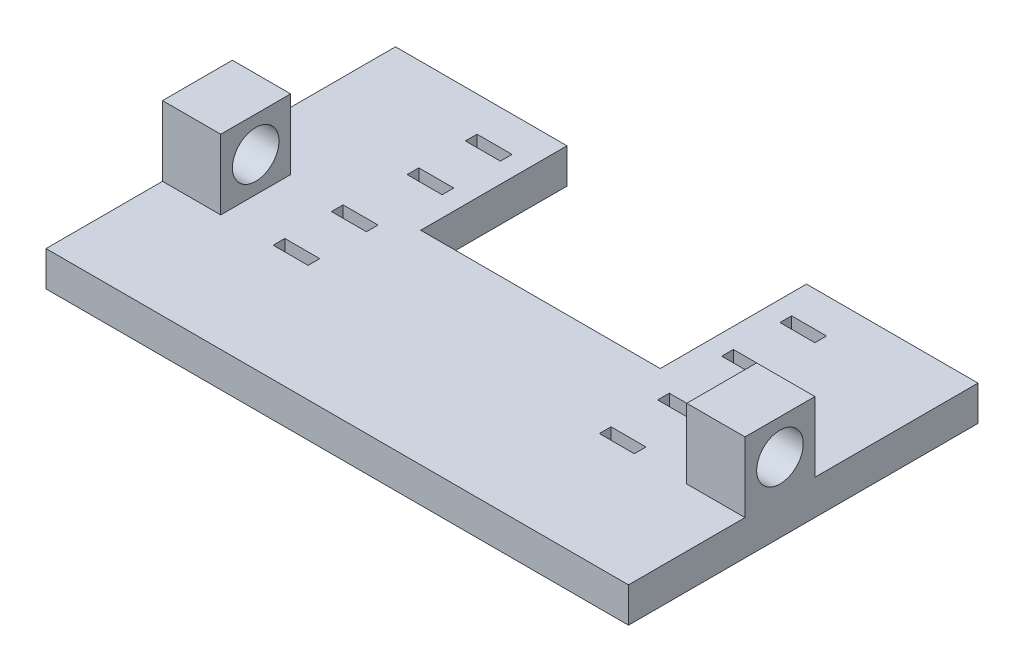
from build123d import *

# Parameters (mm, degrees)
SKETCH1_W                = 6
SKETCH1_H                = 8
BOSS_EXTRUDE1_DEPTH      = 3
SKETCH3_W                = 5
SKETCH3_H                = 6
BOSS_EXTRUDE3_DEPTH      = 6
SKETCH4_R                = 2
CUT_EXTRUDE1_DEPTH       = 53.971690553
BOSS_EXTRUDE4_DEPTH      = 6
BOSS_EXTRUDE4_DEPTH_BACK = 3
SKETCH5_W                = 6
SKETCH5_H                = 8
SKETCH6_R                = 2
CUT_EXTRUDE2_DEPTH       = 6
SKETCH7_W                = 3
SKETCH7_H                = 1
CUT_EXTRUDE3_DEPTH       = 10
CUT_EXTRUDE4_DEPTH       = 10
CUT_EXTRUDE4_DEPTH_BACK  = 10
SKETCH8_W                = 3
SKETCH8_H                = 1
SKETCH8_W_2              = 20.55867335
SKETCH8_H_2              = 13.11372747


with BuildPart() as part:
    # Sketch1 → Boss-Extrude1 (new body)
    with BuildSketch(Plane(origin=(0, 0, 0), x_dir=(1, 0, 0), z_dir=(0, 1, 0))):
        Polygon((3, 15), (25, 15), (25, -15), (-25, -15), (-25, 15), (-3, 15), align=None)
        with Locations((0, 9)):
            Rectangle(SKETCH1_W, SKETCH1_H, mode=Mode.SUBTRACT)
    extrude(amount=BOSS_EXTRUDE1_DEPTH)

    # Sketch3 → Boss-Extrude3 (add)
    with BuildSketch(Plane(origin=(0, 3, 0), x_dir=(1, 0, 0), z_dir=(0, 1, 0))):
        with Locations((-22.5, -2)):
            Rectangle(SKETCH3_W, SKETCH3_H)
        with Locations((22.5, -2)):
            Rectangle(SKETCH3_W, SKETCH3_H)
    extrude(amount=BOSS_EXTRUDE3_DEPTH)

    # Sketch4 → Cut-Extrude1 (cut, through all)
    with BuildSketch(Plane.ZY.offset(25)):
        with Locations((2, 6)):
            Circle(SKETCH4_R)
    extrude(amount=-CUT_EXTRUDE1_DEPTH, mode=Mode.SUBTRACT)

    # Sketch5 → Boss-Extrude4 (add, two sides: drawn at the far end of the back side and taken through both)
    with BuildSketch(Plane(origin=(0, 3, 0), x_dir=(-1, 0, 0), z_dir=(0, 1, 0)).offset(-BOSS_EXTRUDE4_DEPTH_BACK)):
        with Locations((0, -9)):
            Rectangle(SKETCH5_W, SKETCH5_H)
    extrude(amount=BOSS_EXTRUDE4_DEPTH + BOSS_EXTRUDE4_DEPTH_BACK)

    # Sketch6 → Cut-Extrude2 (cut)
    with BuildSketch(Plane.ZY.offset(3)):
        with Locations((-9, 6)):
            Circle(SKETCH6_R)
    extrude(amount=-CUT_EXTRUDE2_DEPTH, mode=Mode.SUBTRACT)

    # Sketch7 → Cut-Extrude3 (cut)
    with BuildSketch(Plane(origin=(0, 3, 0), x_dir=(-1, 0, 0), z_dir=(0, 1, 0))):
        with Locations((14, -0.5)):
            Rectangle(SKETCH7_W, SKETCH7_H)
        with Locations((-14, -0.5)):
            Rectangle(SKETCH7_W, SKETCH7_H)
        with Locations((-14, 4.5)):
            Rectangle(SKETCH7_W, SKETCH7_H)
        with Locations((14, 4.5)):
            Rectangle(SKETCH7_W, SKETCH7_H)
    extrude(amount=-CUT_EXTRUDE3_DEPTH, mode=Mode.SUBTRACT)

    # Sketch8 → Cut-Extrude4 (cut, two sides: drawn at the far end of the back side and taken through both)
    with BuildSketch(Plane(origin=(0, 3, 0), x_dir=(1, 0, 0), z_dir=(0, 1, 0)).offset(-CUT_EXTRUDE4_DEPTH_BACK)):
        with Locations((-13.5, 11.5)):
            Rectangle(SKETCH8_W, SKETCH8_H)
        with Locations((13.5, 11.5)):
            Rectangle(SKETCH8_W, SKETCH8_H)
        with Locations((-13.5, 6.5)):
            Rectangle(SKETCH8_W, SKETCH8_H)
        with Locations((13.5, 6.5)):
            Rectangle(SKETCH8_W, SKETCH8_H)
        with Locations((0, 9)):
            Rectangle(SKETCH8_W_2, SKETCH8_H_2)
    extrude(amount=CUT_EXTRUDE4_DEPTH + CUT_EXTRUDE4_DEPTH_BACK, mode=Mode.SUBTRACT)


solid = part.part
